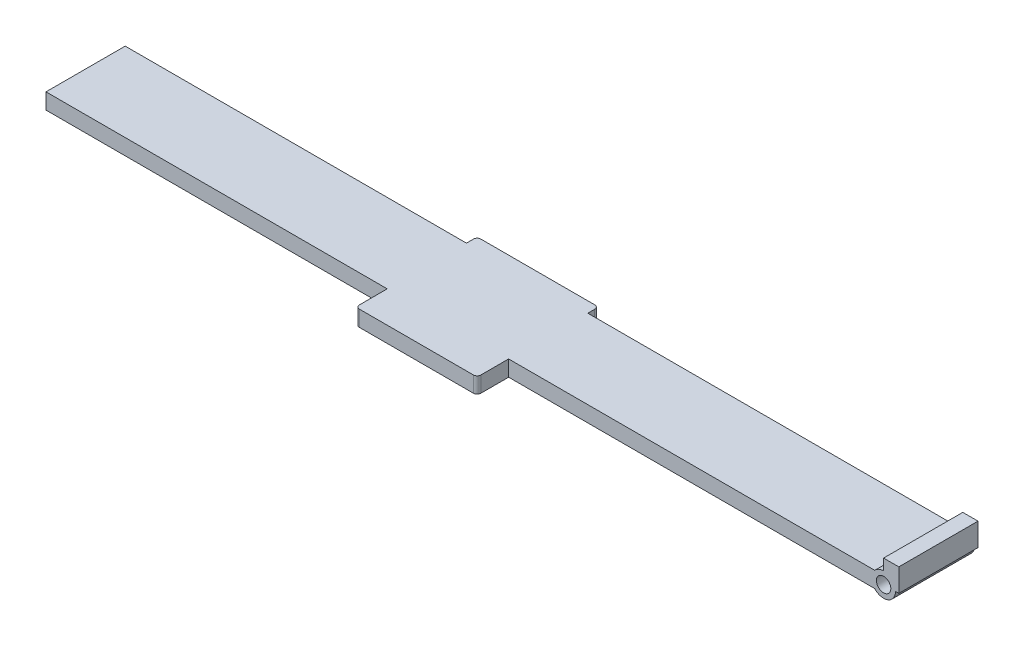
from build123d import *

# Parameters (mm, degrees)
SKETCH1_W      = 528.8
SKETCH1_H      = 50
EXTRUDE2_DEPTH = 10
SKETCH2_R      = 7.5
EXTRUDE3_DEPTH = 50
SKETCH3_W      = 9.599831793
SKETCH3_H      = 14.484799928
EXTRUDE4_DEPTH = 50
SKETCH5_R      = 4.55017582
EXTRUDE5_DEPTH = 50
EXTRUDE6_DEPTH = 10


with BuildPart() as part:
    # Sketch1 → Extrude2 (new body)
    with BuildSketch(Plane(origin=(0, 0, 0), x_dir=(1, 0, 0), z_dir=(0, 1, 0))):
        Rectangle(SKETCH1_W, SKETCH1_H)
    extrude(amount=EXTRUDE2_DEPTH)

    # Sketch2 → Extrude3 (add)
    with BuildSketch(Plane.XY.offset(25)):
        with Locations((264.4, 5)):
            Circle(SKETCH2_R)
    extrude(amount=-EXTRUDE3_DEPTH)

    # Sketch3 → Extrude4 (add)
    with BuildSketch(Plane.XY.offset(25)):
        with Locations((269.199915896, 12.242399964)):
            Rectangle(SKETCH3_W, SKETCH3_H)
    extrude(amount=-EXTRUDE4_DEPTH)

    # Sketch5 → Extrude5 (cut)
    with BuildSketch(Plane.XY.offset(25)):
        with Locations((264.4, 5)):
            Circle(SKETCH5_R)
    extrude(amount=-EXTRUDE5_DEPTH, mode=Mode.SUBTRACT)

    # Sketch6 → Extrude6 (add)
    with BuildSketch(Plane(origin=(0, 0, 0), x_dir=(1, 0, 0), z_dir=(0, 1, 0))):
        with BuildLine():
            Line((-48.968651803, 29.346426348), (-48.968651803, -42.454090949))
            add(Edge.make_bspline(
                [(-48.968651803, -42.454090949), (-48.968651803, -44.874729009), (-46.548013742, -44.874729009)],
                knots=[5.620479698, 5.620479698, 5.620479698, 6.945890916, 6.945890916, 6.945890916], degree=2, weights=[1, 0.788330488, 1]))
            Line((-46.548013742, -44.874729009), (25.252503554, -44.874729009))
            add(Edge.make_bspline(
                [(25.252503554, -44.874729009), (27.673141615, -44.874729009), (27.673141615, -42.454090949)],
                knots=[5.620479698, 5.620479698, 5.620479698, 6.945890916, 6.945890916, 6.945890916], degree=2, weights=[1, 0.788330488, 1]))
            Line((27.673141615, -42.454090949), (27.673141615, 29.346426348))
            add(Edge.make_bspline(
                [(27.673141615, 29.346426348), (27.673141615, 31.767064408), (25.252503554, 31.767064408)],
                knots=[5.620479698, 5.620479698, 5.620479698, 6.945890916, 6.945890916, 6.945890916], degree=2, weights=[1, 0.788330488, 1]))
            Line((25.252503554, 31.767064408), (-46.548013742, 31.767064408))
            add(Edge.make_bspline(
                [(-46.548013742, 31.767064408), (-48.968651803, 31.767064408), (-48.968651803, 29.346426348)],
                knots=[5.620479698, 5.620479698, 5.620479698, 6.945890916, 6.945890916, 6.945890916], degree=2, weights=[1, 0.788330488, 1]))
        make_face()
    extrude(amount=EXTRUDE6_DEPTH)


solid = part.part
